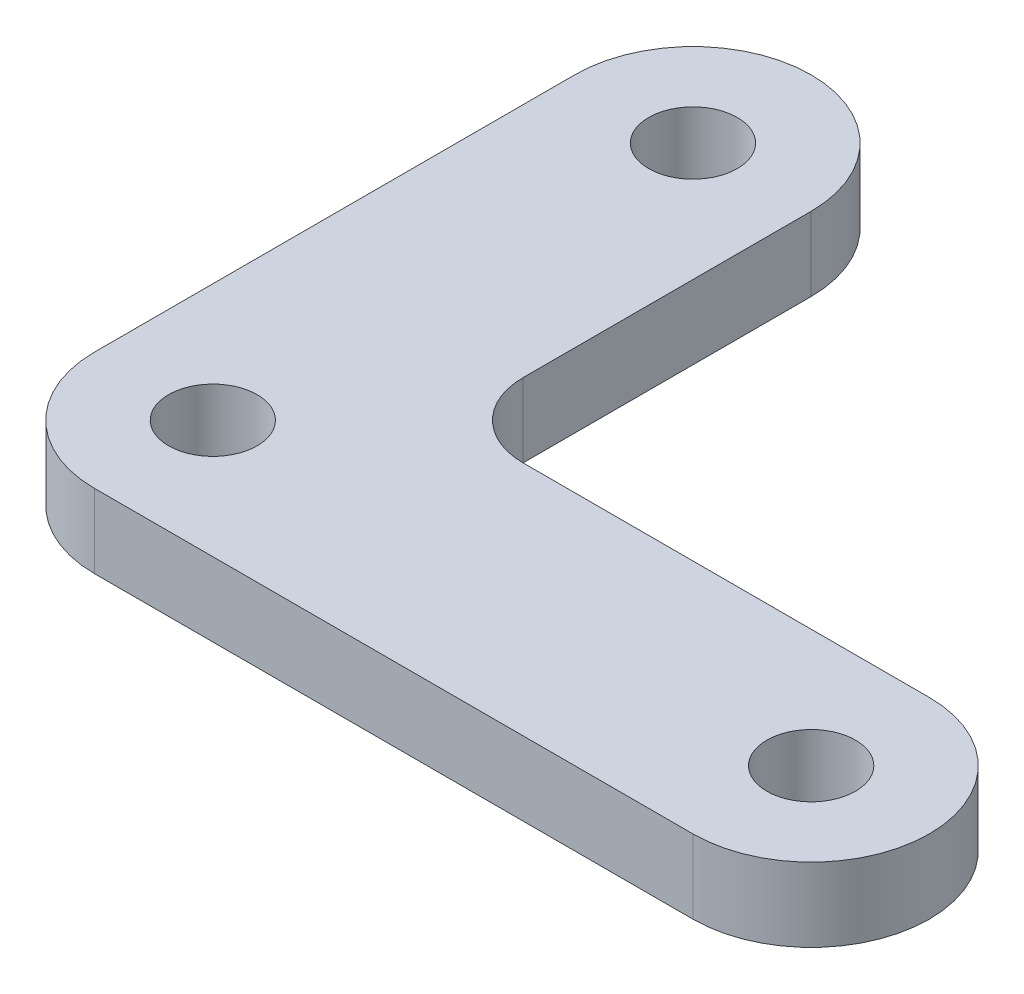
from build123d import *

# Parameters (mm, degrees)
SKETCH1_R           = 6
BOSS_EXTRUDE1_DEPTH = 10


with BuildPart() as part:
    # Sketch1 → Boss-Extrude1 (new body)
    with BuildSketch(Plane(origin=(0, 0, 0), x_dir=(1, 0, 0), z_dir=(0, 1, 0))):
        with BuildLine():
            Line((-16, 65), (-16, 0))
            ThreePointArc((-16, 0), (-11.313708499, -11.313708499), (0, -16))
            Line((0, -16), (81, -16))
            ThreePointArc((81, -16), (97, 0), (81, 16))
            Line((81, 16), (26, 16))
            ThreePointArc((26, 16), (18.928932188, 18.928932188), (16, 26))
            Line((16, 26), (16, 65))
            ThreePointArc((16, 65), (0, 81), (-16, 65))
        make_face()
        with Locations(Location((0, 0, 0), (0, 0, 270))):
            Circle(SKETCH1_R, mode=Mode.SUBTRACT)
        with Locations(Location((81, 0, 0), (0, 0, 270))):
            Circle(SKETCH1_R, mode=Mode.SUBTRACT)
        with Locations(Location((0, 65, 0), (0, 0, 270))):
            Circle(SKETCH1_R, mode=Mode.SUBTRACT)
    extrude(amount=BOSS_EXTRUDE1_DEPTH)


solid = part.part
